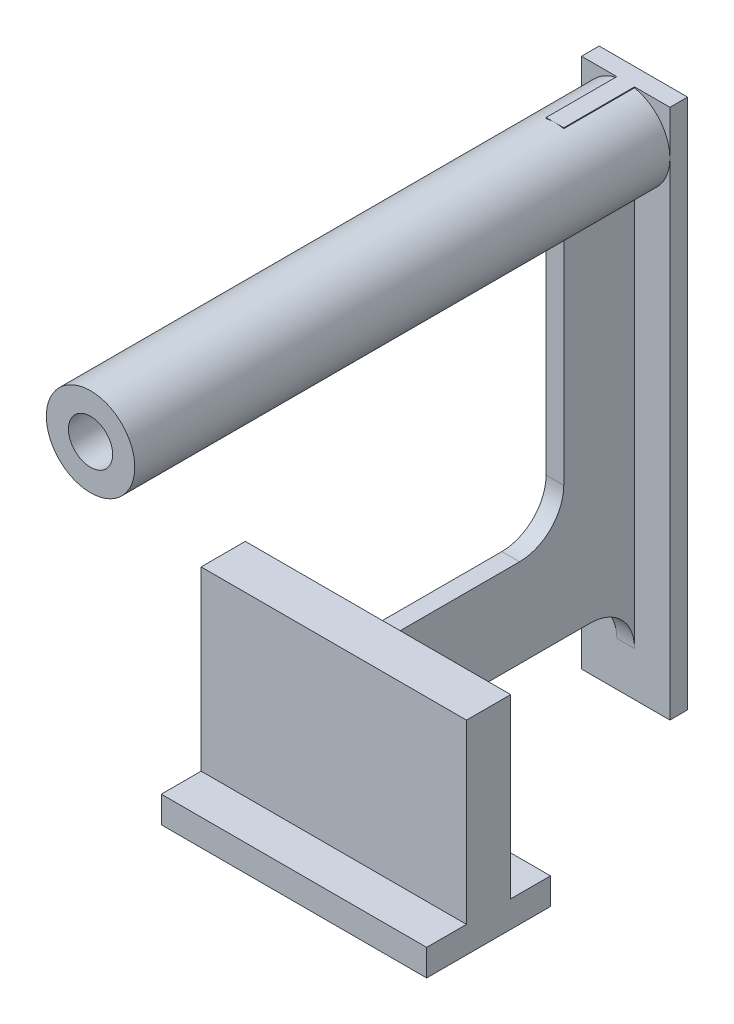
from build123d import *

# Parameters (mm, degrees)
SKETCH1_W                       = 5
SKETCH1_H                       = 20
SKETCH1_W_2                     = 14
SKETCH1_H_2                     = 3
BOSS_EXTRUDE1_DEPTH             = 30
SKETCH4_W                       = 4
SKETCH4_H                       = 2
SKETCH4_W_2                     = 2
SKETCH4_H_2                     = 8
BOSS_EXTRUDE2_DEPTH             = 60
SKETCH4_4_W                     = 2
SKETCH4_4_H                     = 20
BOSS_EXTRUDE3_DEPTH             = 20
SKETCH4_5_W                     = 2
SKETCH4_5_H                     = 8
SKETCH4_5_H_2                   = 20
CUT_EXTRUDE1_DEPTH              = 10
SKETCH2_R                       = 5
SKETCH2_R_2                     = 2.5
BOSS_EXTRUDE4_DEPTH             = 30
BOSS_EXTRUDE4_DIRECTION_2_REACH = 76.54
FILLET1_R                       = 5


with BuildPart() as part:
    # Sketch1 → Boss-Extrude1 (new body)
    with BuildSketch(Plane(origin=(0, 0, 0), x_dir=(0, 0, -1), z_dir=(1, 0, 0))):
        with Locations((0, 11.5)):
            Rectangle(SKETCH1_W, SKETCH1_H)
        Rectangle(SKETCH1_W_2, SKETCH1_H_2)
    extrude(amount=BOSS_EXTRUDE1_DEPTH)



with BuildPart() as body_2:
    # Sketch4 → Boss-Extrude2 (new body)
    with BuildSketch(Plane(origin=(0, 0, 0), x_dir=(1, 0, 0), z_dir=(0, 1, 0))):
        with Locations((18, 31.5)):
            Rectangle(SKETCH4_W, SKETCH4_H)
        with Locations((15, 31.5)):
            Rectangle(SKETCH4_W_2, SKETCH4_H)
        with Locations((12, 31.5)):
            Rectangle(SKETCH4_W, SKETCH4_H)
        with Locations((15, 26.5)):
            Rectangle(SKETCH4_W_2, SKETCH4_H_2)
    extrude(amount=BOSS_EXTRUDE2_DEPTH)


with BuildPart() as part_1:
    add(part.part)

    add(body_2.part)  # Boss-Extrude3 merges body 2
    # Sketch4<4> → Boss-Extrude3 (add)
    with BuildSketch(Plane(origin=(0, 0, 0), x_dir=(1, 0, 0), z_dir=(0, 1, 0))):
        with Locations((15, 12.5)):
            Rectangle(SKETCH4_4_W, SKETCH4_4_H)
    extrude(amount=BOSS_EXTRUDE3_DEPTH)

    # Sketch4<5> → Cut-Extrude1 (cut)
    with BuildSketch(Plane(origin=(0, 0, 0), x_dir=(1, 0, 0), z_dir=(0, 1, 0))):
        with Locations((15, 26.5)):
            Rectangle(SKETCH4_5_W, SKETCH4_5_H)
        with Locations((15, 12.5)):
            Rectangle(SKETCH4_5_W, SKETCH4_5_H_2)
    extrude(amount=CUT_EXTRUDE1_DEPTH, mode=Mode.SUBTRACT)

    # Sketch2 → Boss-Extrude4 (add)
    with BuildSketch(Plane.XY):
        with Locations((15, 55)):
            Circle(SKETCH2_R)
        with Locations((15, 55)):
            Circle(SKETCH2_R_2, mode=Mode.SUBTRACT)
    extrude(amount=BOSS_EXTRUDE4_DEPTH)

    # Boss-Extrude4 direction 2: up to this face of the body (flat: up to its plane)
    boss_extrude4_direction_2_end = Plane(part_1.part.faces().sort_by_distance((15, 30, -32.5))[0])
    # Sketch2 → Boss-Extrude4 direction 2 (add, up to the picked face)
    with BuildSketch(Plane.XY, mode=Mode.PRIVATE) as boss_extrude4_direction_2_sk1:
        with Locations((15, 55)):
            Circle(SKETCH2_R)
        with Locations((15, 55)):
            Circle(SKETCH2_R_2, mode=Mode.SUBTRACT)
    boss_extrude4_direction_2_tool1 = split(extrude(boss_extrude4_direction_2_sk1.sketch, amount=-BOSS_EXTRUDE4_DIRECTION_2_REACH, mode=Mode.PRIVATE), bisect_by=boss_extrude4_direction_2_end, keep=Keep.BOTH, mode=Mode.PRIVATE)
    add(boss_extrude4_direction_2_tool1.solids().sort_by(Axis((10.141421, 55, 0), (0, 0, -1)))[0])

    # Fillet1
    fillet1_edges = [part_1.edges().sort_by_distance(p)[0] for p in [
        (15, 20, -22.5),
        (15, 10, -30.5),
    ]]
    fillet(fillet1_edges, radius=FILLET1_R)


solid = part_1.part
